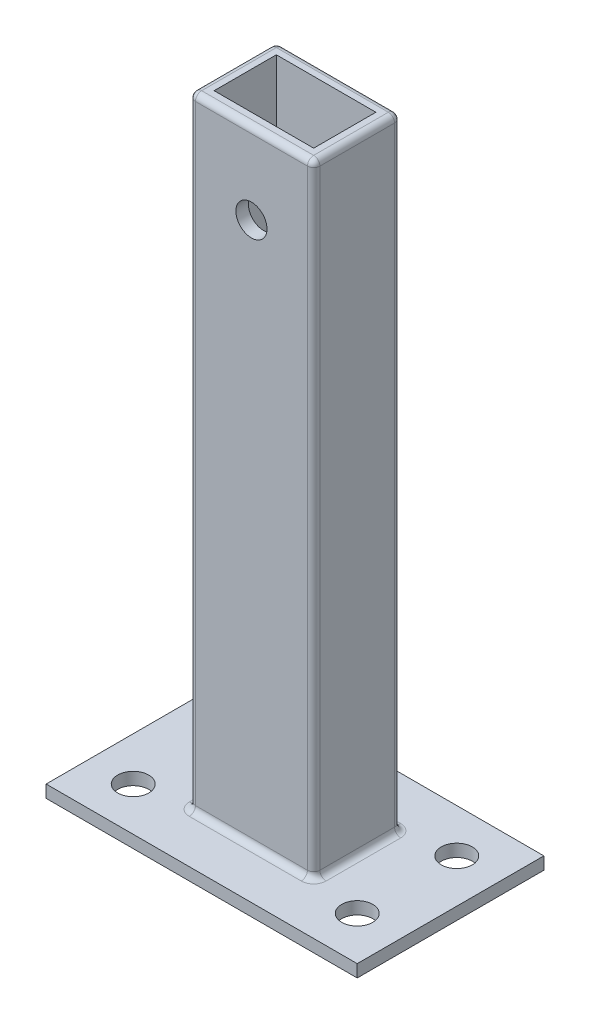
from build123d import *

# Parameters (mm, degrees)
SKETCH1_W           = 20
SKETCH1_H           = 14
SKETCH1_W_2         = 16
SKETCH1_H_2         = 10
BOSS_EXTRUDE1_DEPTH = 100
SKETCH2_W           = 50
SKETCH2_H           = 30
BOSS_EXTRUDE2_DEPTH = 2
SKETCH3_R           = 2.5
CUT_EXTRUDE1_DEPTH  = 2
SKETCH4_R           = 2.5
CUT_EXTRUDE2_DEPTH  = 106.399240984
FILLET1_R           = 1


with BuildPart() as part:
    # Sketch1 → Boss-Extrude1 (new body)
    with BuildSketch(Plane(origin=(0, 0, 0), x_dir=(1, 0, 0), z_dir=(0, 1, 0))):
        Rectangle(SKETCH1_W, SKETCH1_H)
        Rectangle(SKETCH1_W_2, SKETCH1_H_2, mode=Mode.SUBTRACT)
    extrude(amount=BOSS_EXTRUDE1_DEPTH)

    # Sketch2 → Boss-Extrude2 (add)
    with BuildSketch(Plane(origin=(0, 0, 0), x_dir=(-1, 0, 0), z_dir=(0, -1, 0))):
        Rectangle(SKETCH2_W, SKETCH2_H)
    extrude(amount=BOSS_EXTRUDE2_DEPTH)

    # Sketch3 → Cut-Extrude1 (cut)
    with BuildSketch(Plane(origin=(0, 0, 0), x_dir=(1, 0, 0), z_dir=(0, 1, 0))):
        with Locations(Location((18, -8, 0), (0, 0, 270))):
            Circle(SKETCH3_R)
        with Locations(Location((18, 8, 0), (0, 0, 90))):
            Circle(SKETCH3_R)
        with Locations(Location((-18, -8, 0), (0, 0, 90))):
            Circle(SKETCH3_R)
        with Locations(Location((-18, 8, 0), (0, 0, 270))):
            Circle(SKETCH3_R)
    extrude(amount=-CUT_EXTRUDE1_DEPTH, mode=Mode.SUBTRACT)

    # Sketch4 → Cut-Extrude2 (cut, through all)
    with BuildSketch(Plane.XY.offset(7)):
        with Locations((0, 87)):
            Circle(SKETCH4_R)
    extrude(amount=-CUT_EXTRUDE2_DEPTH, mode=Mode.SUBTRACT)

    # Fillet1
    fillet1_edges = [part.edges().sort_by_distance(p)[0] for p in [
        (-10, 100, 0),
        (0, 100, 7),
        (10, 100, 0),
        (0, 0, 7),
        (-10, 0, 0),
        (0, 0, -7),
        (10, 0, 0),
        (10, 50, 7),
        (-10, 50, 7),
        (-10, 50, -7),
        (10, 50, -7),
        (0, 100, -7),
    ]]
    fillet(fillet1_edges, radius=FILLET1_R)


solid = part.part
